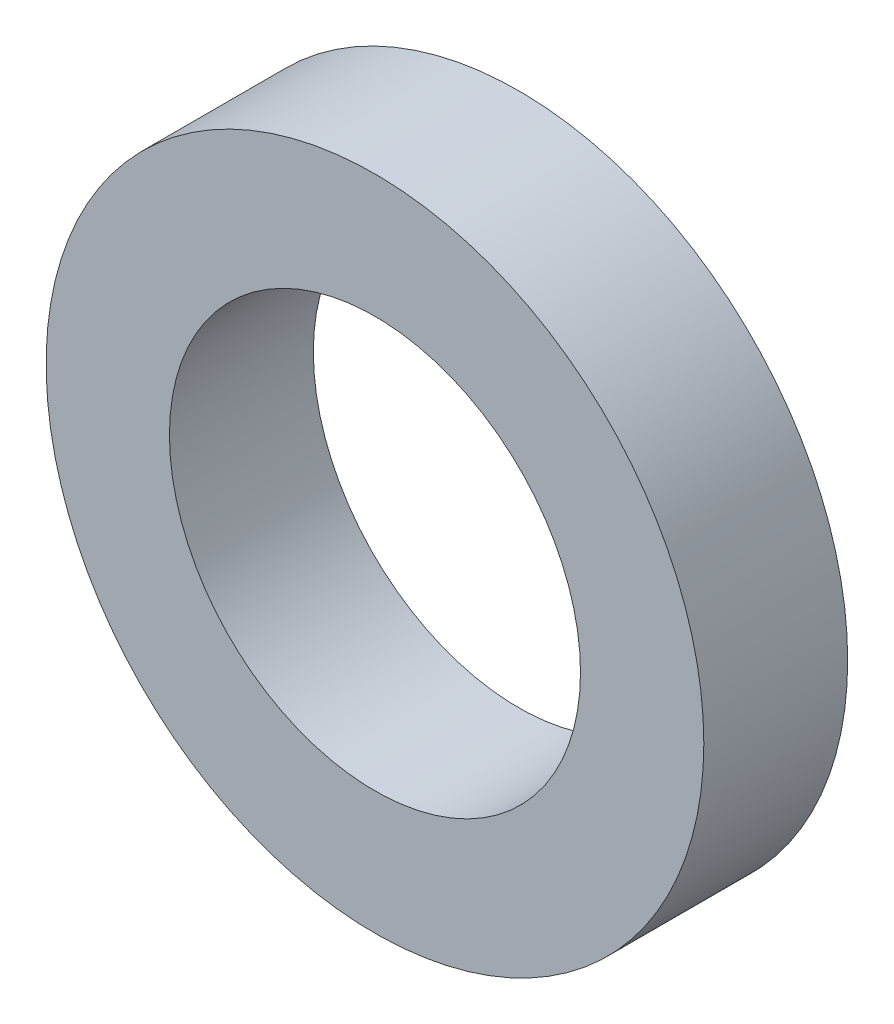
from build123d import *

# Parameters (mm, degrees)
SKETCH1_R           = 16
SKETCH1_R_2         = 10
BOSS_EXTRUDE1_DEPTH = 7


with BuildPart() as part:
    # Sketch1 → Boss-Extrude1 (new body)
    with BuildSketch(Plane.XY):
        Circle(SKETCH1_R)
        Circle(SKETCH1_R_2, mode=Mode.SUBTRACT)
    extrude(amount=BOSS_EXTRUDE1_DEPTH)


solid = part.part
